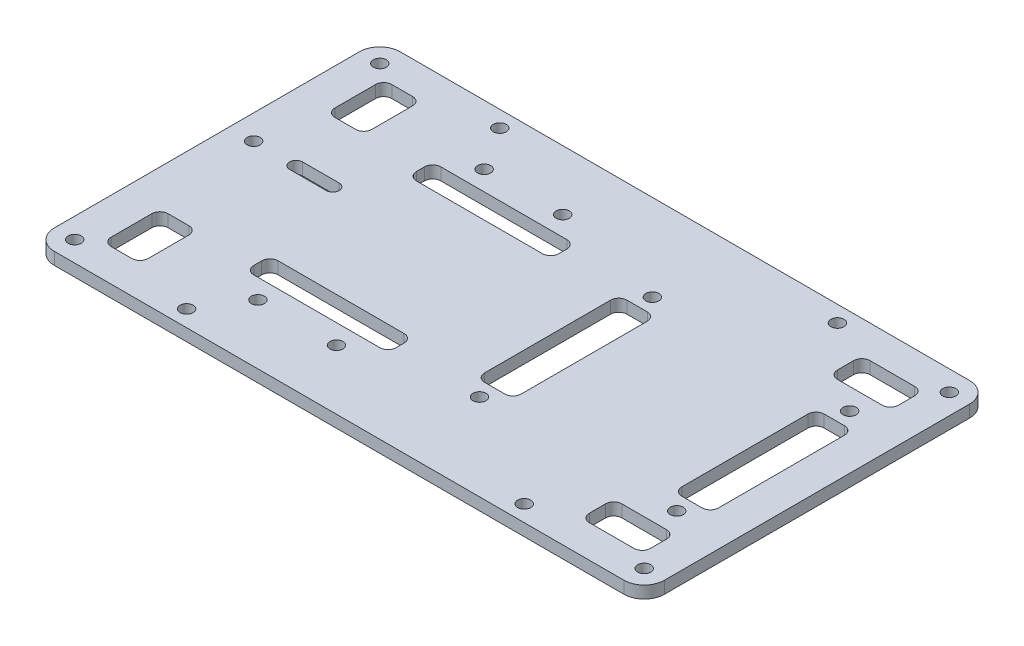
from build123d import *

# Parameters (mm, degrees)
SKETCH1_R           = 1.6
BOSS_EXTRUDE1_DEPTH = 3


with BuildPart() as part:
    # Sketch1 → Boss-Extrude1 (new body)
    with BuildSketch(Plane(origin=(0, 0, 0), x_dir=(1, 0, 0), z_dir=(0, 1, 0))):
        with BuildLine():
            Line((-70, 42.5), (70, 42.5))
            ThreePointArc((70, 42.5), (73.535533906, 41.035533906), (75, 37.5))
            Line((75, 37.5), (75, -37.5))
            ThreePointArc((75, -37.5), (73.535533906, -41.035533906), (70, -42.5))
            Line((70, -42.5), (-70, -42.5))
            ThreePointArc((-70, -42.5), (-73.535533906, -41.035533906), (-75, -37.5))
            Line((-75, -37.5), (-75, 37.5))
            ThreePointArc((-75, 37.5), (-73.535533906, 41.035533906), (-70, 42.5))
        make_face()
        with Locations(Location((13.25, 21.25, 0), (0, 0, 270))):
            Circle(SKETCH1_R, mode=Mode.SUBTRACT)
        with Locations(Location((-70, 37.5, 0), (0, 0, 270))):
            Circle(SKETCH1_R, mode=Mode.SUBTRACT)
        with Locations(Location((-70, -37.5, 0), (0, 0, 90))):
            Circle(SKETCH1_R, mode=Mode.SUBTRACT)
        with Locations(Location((70, -37.5, 0), (0, 0, 270))):
            Circle(SKETCH1_R, mode=Mode.SUBTRACT)
        with Locations(Location((70, 37.5, 0), (0, 0, 90))):
            Circle(SKETCH1_R, mode=Mode.SUBTRACT)
        with Locations(Location((61.75, 21.25, 0), (0, 0, 270))):
            Circle(SKETCH1_R, mode=Mode.SUBTRACT)
        with Locations(Location((13.25, -21.25, 0), (0, 0, 90))):
            Circle(SKETCH1_R, mode=Mode.SUBTRACT)
        with Locations(Location((61.75, -21.25, 0), (0, 0, 90))):
            Circle(SKETCH1_R, mode=Mode.SUBTRACT)
        with Locations(Location((-34.65, 27.81, 0), (0, 0, 270))):
            Circle(SKETCH1_R, mode=Mode.SUBTRACT)
        with Locations(Location((-34.65, -27.81, 0), (0, 0, 90))):
            Circle(SKETCH1_R, mode=Mode.SUBTRACT)
        with Locations(Location((-15.35, -27.81, 0), (0, 0, 270))):
            Circle(SKETCH1_R, mode=Mode.SUBTRACT)
        with Locations(Location((-15.35, 27.81, 0), (0, 0, 90))):
            Circle(SKETCH1_R, mode=Mode.SUBTRACT)
        with Locations(Location((-41.5, 38.5, 0), (0, 0, 270))):
            Circle(SKETCH1_R, mode=Mode.SUBTRACT)
        with Locations(Location((-41.5, -38.5, 0), (0, 0, 90))):
            Circle(SKETCH1_R, mode=Mode.SUBTRACT)
        with Locations(Location((41.5, -38.5, 0), (0, 0, 270))):
            Circle(SKETCH1_R, mode=Mode.SUBTRACT)
        with Locations(Location((41.5, 38.5, 0), (0, 0, 90))):
            Circle(SKETCH1_R, mode=Mode.SUBTRACT)
        with Locations(Location((-68.96, 5.46, 0), (0, 0, 270))):
            Circle(SKETCH1_R, mode=Mode.SUBTRACT)
        with BuildLine():
            Line((10.75, 17.5), (15.75, 17.5))
            ThreePointArc((15.75, 17.5), (17.164213562, 16.914213562), (17.75, 15.5))
            Line((17.75, 15.5), (17.75, -15.5))
            ThreePointArc((17.75, -15.5), (17.164213562, -16.914213562), (15.75, -17.5))
            Line((15.75, -17.5), (10.75, -17.5))
            ThreePointArc((10.75, -17.5), (9.335786438, -16.914213562), (8.75, -15.5))
            Line((8.75, -15.5), (8.75, 15.5))
            ThreePointArc((8.75, 15.5), (9.335786438, 16.914213562), (10.75, 17.5))
        make_face(mode=Mode.SUBTRACT)
        with BuildLine():
            Line((64.25, -17.5), (59.25, -17.5))
            ThreePointArc((59.25, -17.5), (57.835786438, -16.914213562), (57.25, -15.5))
            Line((57.25, -15.5), (57.25, 15.5))
            ThreePointArc((57.25, 15.5), (57.835786438, 16.914213562), (59.25, 17.5))
            Line((59.25, 17.5), (64.25, 17.5))
            ThreePointArc((64.25, 17.5), (65.664213562, 16.914213562), (66.25, 15.5))
            Line((66.25, 15.5), (66.25, -15.5))
            ThreePointArc((66.25, -15.5), (65.664213562, -16.914213562), (64.25, -17.5))
        make_face(mode=Mode.SUBTRACT)
        with BuildLine():
            Line((-58.54, 7.06), (-49.54, 7.06))
            ThreePointArc((-49.54, 7.06), (-47.94, 5.46), (-49.54, 3.86))
            Line((-49.54, 3.86), (-58.54, 3.86))
            ThreePointArc((-58.54, 3.86), (-60.14, 5.46), (-58.54, 7.06))
        make_face(mode=Mode.SUBTRACT)
        with BuildLine():
            Line((-64.05, -34.5), (-58.95, -34.5))
            ThreePointArc((-58.95, -34.5), (-57.535786438, -33.914213562), (-56.95, -32.5))
            Line((-56.95, -32.5), (-56.95, -22.5))
            ThreePointArc((-56.95, -22.5), (-57.535786438, -21.085786438), (-58.95, -20.5))
            Line((-58.95, -20.5), (-64.05, -20.5))
            ThreePointArc((-64.05, -20.5), (-65.464213562, -21.085786438), (-66.05, -22.5))
            Line((-66.05, -22.5), (-66.05, -32.5))
            ThreePointArc((-66.05, -32.5), (-65.464213562, -33.914213562), (-64.05, -34.5))
        make_face(mode=Mode.SUBTRACT)
        with BuildLine():
            Line((-64.05, 34.5), (-58.95, 34.5))
            ThreePointArc((-58.95, 34.5), (-57.535786438, 33.914213562), (-56.95, 32.5))
            Line((-56.95, 32.5), (-56.95, 22.5))
            ThreePointArc((-56.95, 22.5), (-57.535786438, 21.085786438), (-58.95, 20.5))
            Line((-58.95, 20.5), (-64.05, 20.5))
            ThreePointArc((-64.05, 20.5), (-65.464213562, 21.085786438), (-66.05, 22.5))
            Line((-66.05, 22.5), (-66.05, 32.5))
            ThreePointArc((-66.05, 32.5), (-65.464213562, 33.914213562), (-64.05, 34.5))
        make_face(mode=Mode.SUBTRACT)
        with BuildLine():
            Line((53.520093719, -34.5), (64.479906281, -34.5))
            ThreePointArc((64.479906281, -34.5), (65.908328248, -33.908328248), (66.5, -32.479906281))
            Line((66.5, -32.479906281), (66.5, -28.520093719))
            ThreePointArc((66.5, -28.520093719), (65.908328248, -27.091671752), (64.479906281, -26.5))
            Line((64.479906281, -26.5), (53.520093719, -26.5))
            ThreePointArc((53.520093719, -26.5), (52.091671752, -27.091671752), (51.5, -28.520093719))
            Line((51.5, -28.520093719), (51.5, -32.479906281))
            ThreePointArc((51.5, -32.479906281), (52.091671752, -33.908328248), (53.520093719, -34.5))
        make_face(mode=Mode.SUBTRACT)
        with BuildLine():
            Line((53.520093719, 34.5), (64.479906281, 34.5))
            ThreePointArc((64.479906281, 34.5), (65.908328248, 33.908328248), (66.5, 32.479906281))
            Line((66.5, 32.479906281), (66.5, 28.520093719))
            ThreePointArc((66.5, 28.520093719), (65.908328248, 27.091671752), (64.479906281, 26.5))
            Line((64.479906281, 26.5), (53.520093719, 26.5))
            ThreePointArc((53.520093719, 26.5), (52.091671752, 27.091671752), (51.5, 28.520093719))
            Line((51.5, 28.520093719), (51.5, 32.479906281))
            ThreePointArc((51.5, 32.479906281), (52.091671752, 33.908328248), (53.520093719, 34.5))
        make_face(mode=Mode.SUBTRACT)
        with BuildLine():
            Line((-7.5, -20.979906281), (-7.5, -19.020093719))
            ThreePointArc((-7.5, -19.020093719), (-8.091671752, -17.591671752), (-9.520093719, -17))
            Line((-9.520093719, -17), (-40.479906281, -17))
            ThreePointArc((-40.479906281, -17), (-41.908328248, -17.591671752), (-42.5, -19.020093719))
            Line((-42.5, -19.020093719), (-42.5, -20.979906281))
            ThreePointArc((-42.5, -20.979906281), (-41.908328248, -22.408328248), (-40.479906281, -23))
            Line((-40.479906281, -23), (-9.520093719, -23))
            ThreePointArc((-9.520093719, -23), (-8.091671752, -22.408328248), (-7.5, -20.979906281))
        make_face(mode=Mode.SUBTRACT)
        with BuildLine():
            Line((-40.479906281, 23), (-9.520093719, 23))
            ThreePointArc((-9.520093719, 23), (-8.091671752, 22.408328248), (-7.5, 20.979906281))
            Line((-7.5, 20.979906281), (-7.5, 19.020093719))
            ThreePointArc((-7.5, 19.020093719), (-8.091671752, 17.591671752), (-9.520093719, 17))
            Line((-9.520093719, 17), (-40.479906281, 17))
            ThreePointArc((-40.479906281, 17), (-41.908328248, 17.591671752), (-42.5, 19.020093719))
            Line((-42.5, 19.020093719), (-42.5, 20.979906281))
            ThreePointArc((-42.5, 20.979906281), (-41.908328248, 22.408328248), (-40.479906281, 23))
        make_face(mode=Mode.SUBTRACT)
    extrude(amount=BOSS_EXTRUDE1_DEPTH)


solid = part.part
